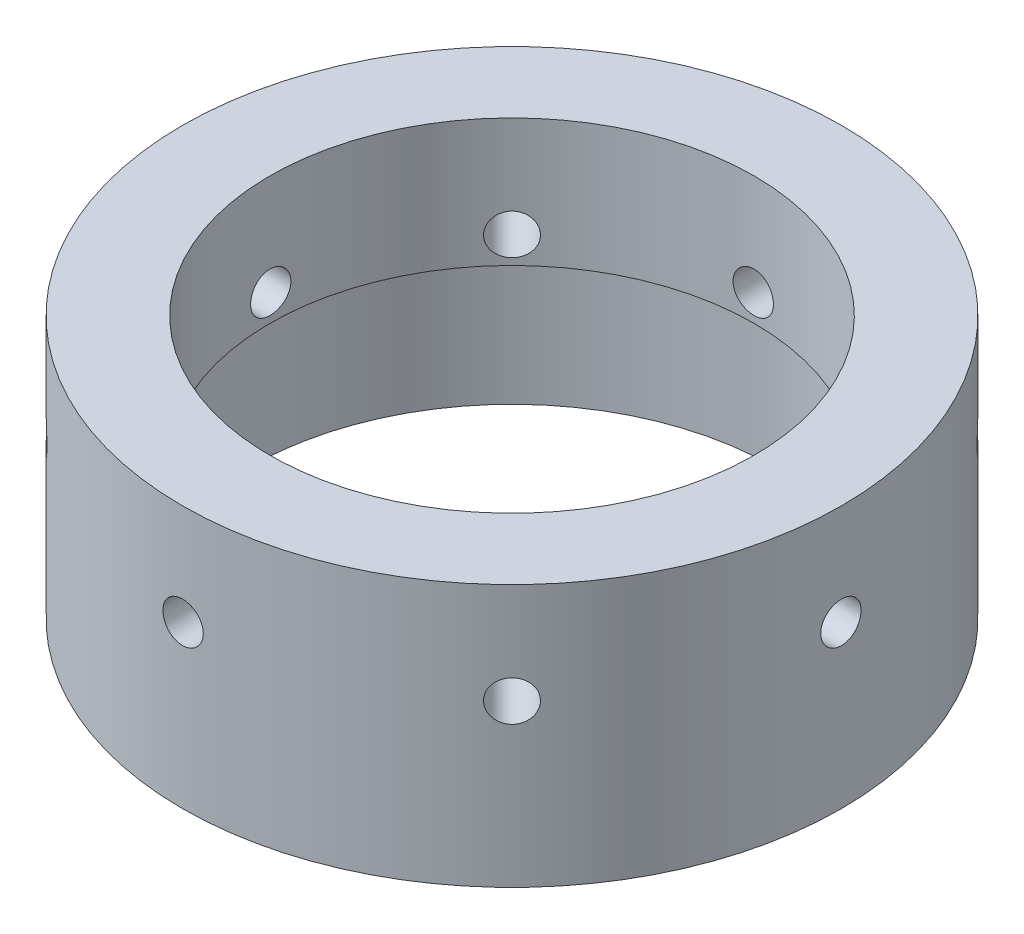
from build123d import *

# Parameters (mm, degrees)
CORTAR_EXTRUIR1_DEPTH      = 88.241045386
CORTAR_EXTRUIR1_DEPTH_BACK = 88.241045386
CROQUIS2_R                 = 3
CORTAR_EXTRUIR2_DEPTH      = 88.241045559
CORTAR_EXTRUIR2_DEPTH_BACK = 88.241045559
CROQUIS3_R                 = 3
CORTAR_EXTRUIR3_DEPTH      = 88.241045559
CORTAR_EXTRUIR3_DEPTH_BACK = 88.241045559
CROQUIS4_R                 = 3
CORTAR_EXTRUIR4_DEPTH      = 88.241045559
CORTAR_EXTRUIR4_DEPTH_BACK = 88.241045559
CROQUIS5_R                 = 3


with BuildPart() as part:
    # Croquis1 → Revolución1 (revolve)
    with BuildSketch(Plane(origin=(0, 0, 0), x_dir=(0, 0, -1), z_dir=(1, 0, 0)), mode=Mode.PRIVATE) as revoluci_n1_sk:
        Polygon((-49, 53), (-36, 53), (-36, 34), (-39, 34), (-39, 14), (-49, 14), align=None)
    revolve(revoluci_n1_sk.sketch.rotate(Axis((0, 0, 0), (0, 1, 0)), 180), axis=Axis((0, 0, 0), (0, 1, 0)))

    # Croquis2 → Cortar-Extruir1 (cut, two sides: drawn at the far end of the back side and taken through both)
    with BuildSketch(Plane(origin=(0, 0, 0), x_dir=(0, 0, -1), z_dir=(1, 0, 0)).offset(-CORTAR_EXTRUIR1_DEPTH_BACK)):
        with Locations((0, 38)):
            Circle(CROQUIS2_R)
    extrude(amount=CORTAR_EXTRUIR1_DEPTH + CORTAR_EXTRUIR1_DEPTH_BACK, mode=Mode.SUBTRACT)

    # Croquis3 → Cortar-Extruir2 (cut, two sides: drawn at the far end of the back side and taken through both)
    with BuildSketch(Plane.XY.offset(-CORTAR_EXTRUIR2_DEPTH_BACK)):
        with Locations((0, 38)):
            Circle(CROQUIS3_R)
    extrude(amount=CORTAR_EXTRUIR2_DEPTH + CORTAR_EXTRUIR2_DEPTH_BACK, mode=Mode.SUBTRACT)

    # Croquis4 → Cortar-Extruir3 (cut, two sides: drawn at the far end of the back side and taken through both)
    with BuildSketch(Plane(origin=(0, 0, 0), x_dir=(-0.7071067811865477, 0, -0.7071067811865475), z_dir=(0.7071067811865475, 0, -0.7071067811865477)).offset(-CORTAR_EXTRUIR3_DEPTH_BACK)):
        with Locations((0, 38.362139971)):
            Circle(CROQUIS4_R)
    extrude(amount=CORTAR_EXTRUIR3_DEPTH + CORTAR_EXTRUIR3_DEPTH_BACK, mode=Mode.SUBTRACT)

    # Croquis5 → Cortar-Extruir4 (cut, two sides: drawn at the far end of the back side and taken through both)
    with BuildSketch(Plane(origin=(0, 0, 0), x_dir=(0.7071067811865502, 0, -0.7071067811865449), z_dir=(0.7071067811865449, 6.982962677686268e-15, 0.7071067811865502)).offset(-CORTAR_EXTRUIR4_DEPTH_BACK)):
        with Locations((0, 38)):
            Circle(CROQUIS5_R)
    extrude(amount=CORTAR_EXTRUIR4_DEPTH + CORTAR_EXTRUIR4_DEPTH_BACK, mode=Mode.SUBTRACT)


solid = part.part
